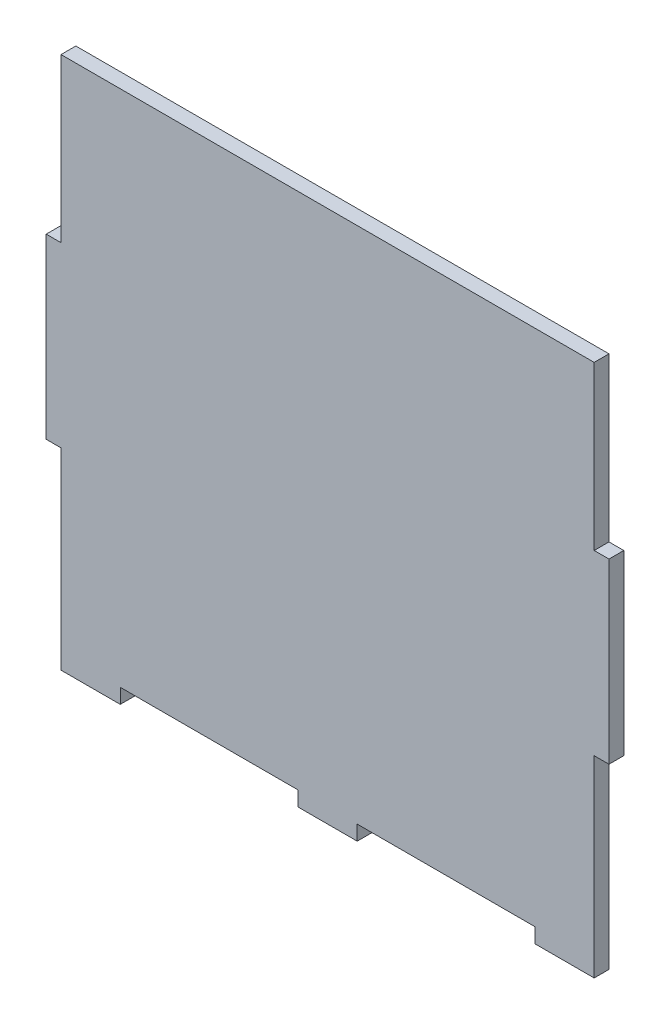
from build123d import *

# Parameters (mm, degrees)
SKETCH1_W           = 6.35
SKETCH1_H           = 76.2
BOSS_EXTRUDE2_DEPTH = 6.35


with BuildPart() as part:
    # Sketch1 → Boss-Extrude2 (new body)
    with BuildSketch(Plane.XY):
        Polygon((118.491, -47.38624), (93.091, -47.38624), (93.091, -41.03624), (16.891, -41.03624), (16.891, -47.38624), (4.191, -47.38624), (-8.509, -47.38624), (-8.509, -41.03624), (-84.709, -41.03624), (-84.709, -47.38624), (-110.109, -47.38624), (-110.109, 181.21376), (118.491, 181.21376), align=None)
        with Locations((-113.284, 73.26376)):
            Rectangle(SKETCH1_W, SKETCH1_H)
        with Locations((121.666, 73.26376)):
            Rectangle(SKETCH1_W, SKETCH1_H)
    extrude(amount=BOSS_EXTRUDE2_DEPTH)


solid = part.part
